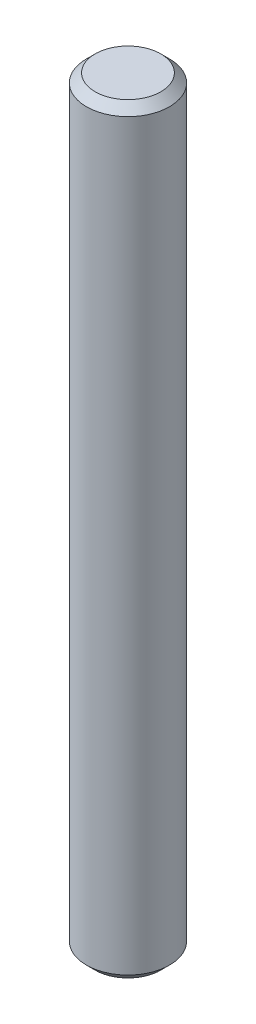
from build123d import *

# Parameters (mm, degrees)
SKETCH1_R           = 1.2
BOSS_EXTRUDE1_DEPTH = 11
CHAMFER1_SIZE       = 0.25


with BuildPart() as part:
    # Sketch1 → Boss-Extrude1 (new, symmetric)
    with BuildSketch(Plane(origin=(0, 0, 0), x_dir=(1, 0, 0), z_dir=(0, 1, 0))):
        with Locations(Location((0, 0, 0), (0, 0, 270))):
            Circle(SKETCH1_R)
    extrude(amount=BOSS_EXTRUDE1_DEPTH, both=True)

    # Chamfer1
    chamfer1_edges = [part.edges().sort_by_distance(p)[0] for p in [
        (0, -11, -1.2),
        (0, 11, -1.2),
    ]]
    chamfer(chamfer1_edges, length=CHAMFER1_SIZE)


solid = part.part
